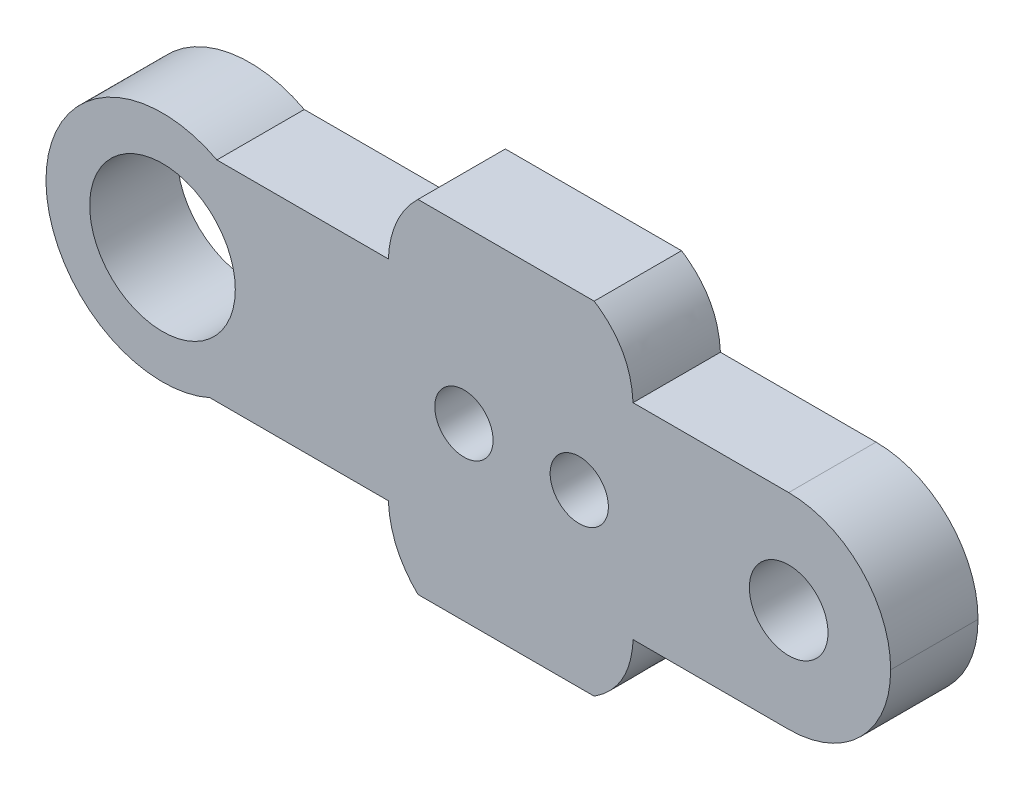
from build123d import *

# Parameters (mm, degrees)
SKETCH_3_R      = 2.5
SKETCH_3_R_2    = 1
SKETCH_3_R_3    = 1.35
EXTRUDE_2_DEPTH = 3


with BuildPart() as part:
    # 草图3 → 凸台-拉伸2 (new body)
    with BuildSketch(Plane.XY):
        with BuildLine():
            Line((21.499968123, 3.52141019), (16.156278552, 3.52141019))
            add(Edge.make_bspline(
                [(16.156278552, 3.52141019), (16.088160339, 5.051537173), (14.821900334, 5.873909505)],
                knots=[0, 0, 0, 1, 1, 1], degree=2))
            Line((14.821900334, 5.873909505), (8.771282217, 5.873909505))
            add(Edge.make_bspline(
                [(7.754778373, 3.595279655), (7.816403966, 4.944689103), (8.771282217, 5.873909505)],
                knots=[0, 0, 0, 1, 1, 1], degree=2))
            Line((7.754778373, 3.595279655), (1.868346732, 3.595279655))
            ThreePointArc((1.868346732, 3.595279655), (-3.997767344, 0.192060873), (1.627998751, -3.595279655))
            Line((1.627998751, -3.595279655), (7.754778373, -3.595279655))
            add(Edge.make_bspline(
                [(7.754778373, -3.595279655), (7.816403966, -4.944689103), (8.771282217, -5.873909505)],
                knots=[0, 0, 0, 1, 1, 1], degree=2))
            Line((8.771282217, -5.873909505), (14.821900334, -5.873909505))
            add(Edge.make_bspline(
                [(16.156278552, -3.52141019), (16.088160339, -5.051537173), (14.821900334, -5.873909505)],
                knots=[0, 0, 0, 1, 1, 1], degree=2))
            Line((16.156278552, -3.52141019), (21.499968123, -3.52141019))
            ThreePointArc((21.499968123, -3.52141019), (23.982399961, -2.488702667), (24.999902637, 0))
            ThreePointArc((24.999902637, 0), (23.982399961, 2.488702667), (21.499968123, 3.52141019))
        make_face()
        with Locations((0, 0.058433534)):
            Circle(SKETCH_3_R, mode=Mode.SUBTRACT)
        with Locations((10.35, 0)):
            Circle(SKETCH_3_R_2, mode=Mode.SUBTRACT)
        with Locations((14.31, 0)):
            Circle(SKETCH_3_R_2, mode=Mode.SUBTRACT)
        with Locations((21.499968123, 0.02141019)):
            Circle(SKETCH_3_R_3, mode=Mode.SUBTRACT)
    extrude(amount=EXTRUDE_2_DEPTH)


solid = part.part
